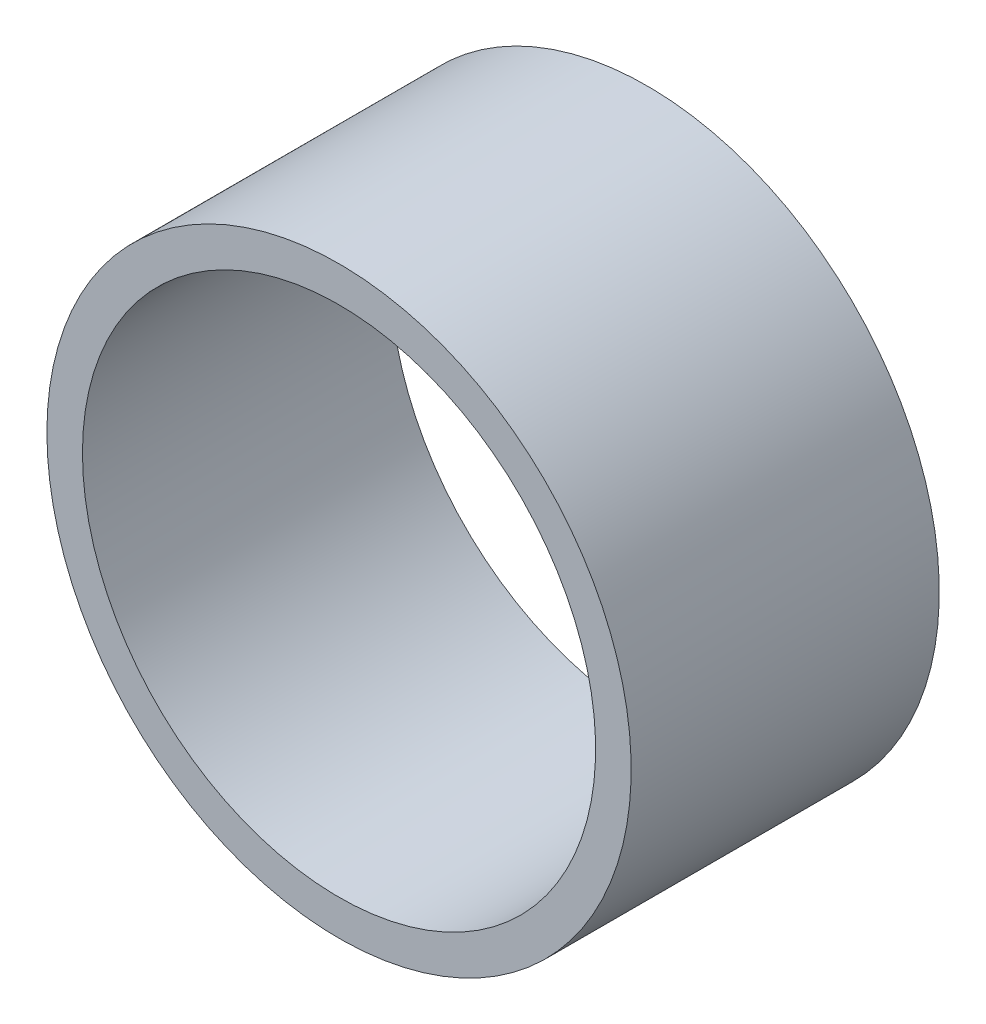
from build123d import *

# Parameters (mm, degrees)
SKETCH1_R           = 6.262000049
SKETCH1_R_2         = 5.5
BOSS_EXTRUDE1_DEPTH = 6.604


with BuildPart() as part:
    # Sketch1 → Boss-Extrude1 (new body)
    with BuildSketch(Plane(origin=(0, 0, 0), x_dir=(0, 1, 0), z_dir=(0, 0, 1))):
        with Locations(Location((0, 0, 0), (0, 0, 90))):
            Circle(SKETCH1_R)
        with Locations(Location((0, 0, 0), (0, 0, 90))):
            Circle(SKETCH1_R_2, mode=Mode.SUBTRACT)
    extrude(amount=BOSS_EXTRUDE1_DEPTH)


solid = part.part
